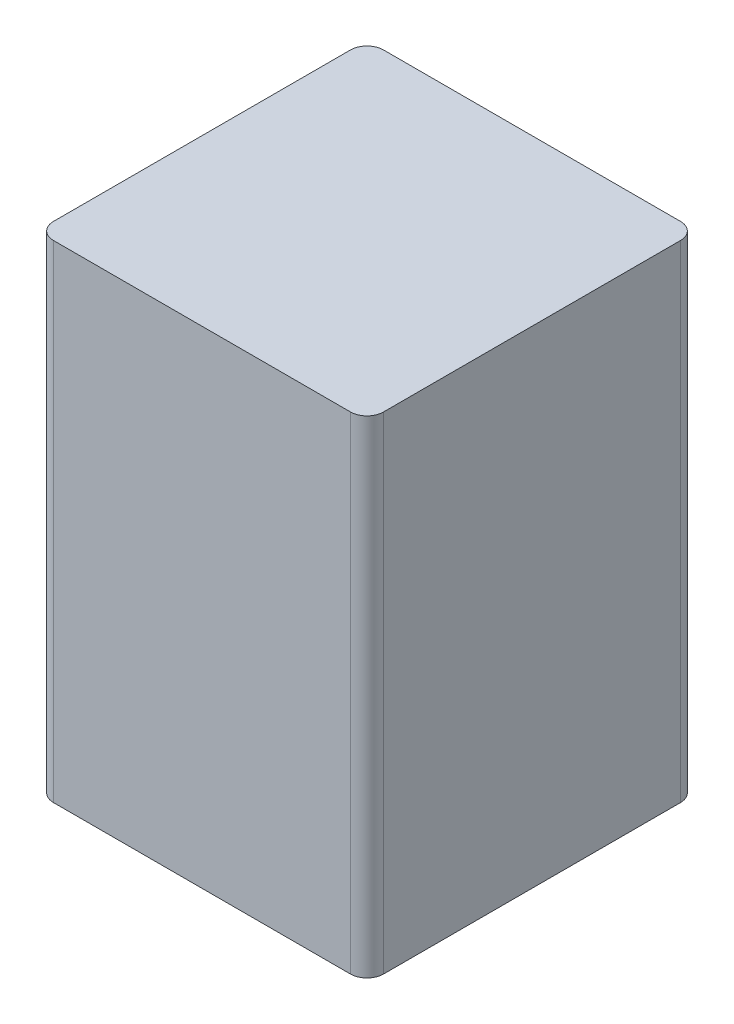
from build123d import *

# Parameters (mm, degrees)
BOSS_EXTRUDE1_DEPTH = 59
SKETCH2_R           = 5
CUT_EXTRUDE1_DEPTH  = 4


with BuildPart() as part:
    # Sketch1 → Boss-Extrude1 (new body)
    with BuildSketch(Plane(origin=(0, 0, 0), x_dir=(1, 0, 0), z_dir=(0, 1, 0))):
        with BuildLine():
            Line((-18.608695652, -27.695652174), (17.391304348, -27.695652174))
            ThreePointArc((17.391304348, -27.695652174), (18.80551791, -27.109865736), (19.391304348, -25.695652174))
            Line((19.391304348, -25.695652174), (19.391304348, 10.304347826))
            ThreePointArc((19.391304348, 10.304347826), (18.80551791, 11.718561388), (17.391304348, 12.304347826))
            Line((17.391304348, 12.304347826), (-18.608695652, 12.304347826))
            ThreePointArc((-18.608695652, 12.304347826), (-20.022909215, 11.718561388), (-20.608695652, 10.304347826))
            Line((-20.608695652, 10.304347826), (-20.608695652, -25.695652174))
            ThreePointArc((-20.608695652, -25.695652174), (-20.022909215, -27.109865736), (-18.608695652, -27.695652174))
        make_face()
    extrude(amount=BOSS_EXTRUDE1_DEPTH)

    # Sketch2 → Cut-Extrude1 (cut)
    with BuildSketch(Plane.XZ):
        with Locations(Location((-0.608695652, 7.695652174, 0), (0, 0, 270))):
            Circle(SKETCH2_R)
    extrude(amount=-CUT_EXTRUDE1_DEPTH, mode=Mode.SUBTRACT)


solid = part.part
